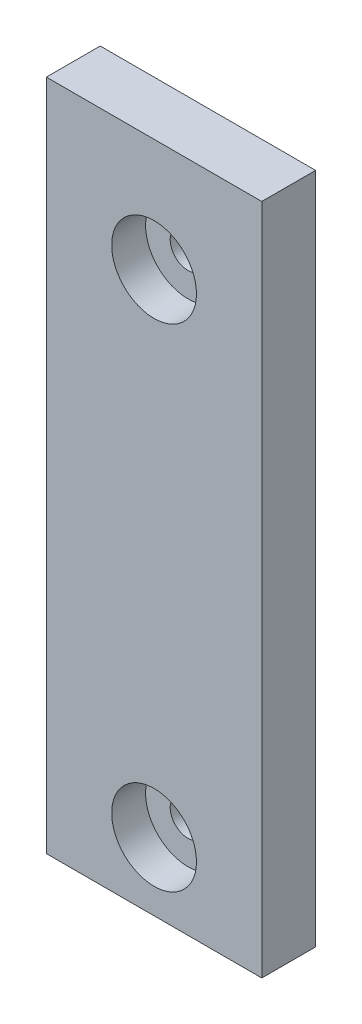
from build123d import *

# Parameters (mm, degrees)
SKETCH1_W           = 25.4
SKETCH1_H           = 6.35
BOSS_EXTRUDE1_DEPTH = 100
SKETCH2_R           = 2.1
CUT_EXTRUDE1_DEPTH  = 110.906322202
SKETCH2_3_R         = 5
CUT_EXTRUDE2_DEPTH  = 4
SKETCH2_4_R         = 5
CUT_EXTRUDE3_DEPTH  = 4
SKETCH5_W           = 25.4
SKETCH5_H           = 5
SKETCH5_H_2         = 12
CUT_EXTRUDE4_DEPTH  = 110.906322202
SKETCH6_W           = 25.4
SKETCH6_H           = 3.7
CUT_EXTRUDE5_DEPTH  = 106.377415322


with BuildPart() as part:
    # Sketch1 → Boss-Extrude1 (new body)
    with BuildSketch(Plane(origin=(0, 0, 0), x_dir=(1, 0, 0), z_dir=(0, 1, 0))):
        with Locations((32.456141995, 0.058688594)):
            Rectangle(SKETCH1_W, SKETCH1_H)
    extrude(amount=BOSS_EXTRUDE1_DEPTH)

    # Sketch2 → Cut-Extrude1 (cut, through all)
    with BuildSketch(Plane.XY.offset(3.116311406)):
        with Locations((32.456141995, 81.7)):
            Circle(SKETCH2_R)
        with Locations((32.456141995, 23.71)):
            Circle(SKETCH2_R)
    extrude(amount=-CUT_EXTRUDE1_DEPTH, mode=Mode.SUBTRACT)

    # Sketch2<3> → Cut-Extrude2 (cut)
    with BuildSketch(Plane.XY.offset(3.116311406)):
        with Locations((32.456141995, 81.7)):
            Circle(SKETCH2_3_R)
    extrude(amount=-CUT_EXTRUDE2_DEPTH, mode=Mode.SUBTRACT)

    # Sketch2<4> → Cut-Extrude3 (cut)
    with BuildSketch(Plane.XY.offset(3.116311406)):
        with Locations((32.456141995, 23.71)):
            Circle(SKETCH2_4_R)
    extrude(amount=-CUT_EXTRUDE3_DEPTH, mode=Mode.SUBTRACT)

    # Sketch5 → Cut-Extrude4 (cut, through all)
    with BuildSketch(Plane.XY.offset(3.116311406)):
        with Locations((32.456141995, 97.5)):
            Rectangle(SKETCH5_W, SKETCH5_H)
        with Locations((32.456141995, 6)):
            Rectangle(SKETCH5_W, SKETCH5_H_2)
    extrude(amount=-CUT_EXTRUDE4_DEPTH, mode=Mode.SUBTRACT)

    # Sketch6 → Cut-Extrude5 (cut, through all)
    with BuildSketch(Plane.XY.offset(3.116311406)):
        with Locations((32.456141995, 13.85)):
            Rectangle(SKETCH6_W, SKETCH6_H)
    extrude(amount=-CUT_EXTRUDE5_DEPTH, mode=Mode.SUBTRACT)


solid = part.part
